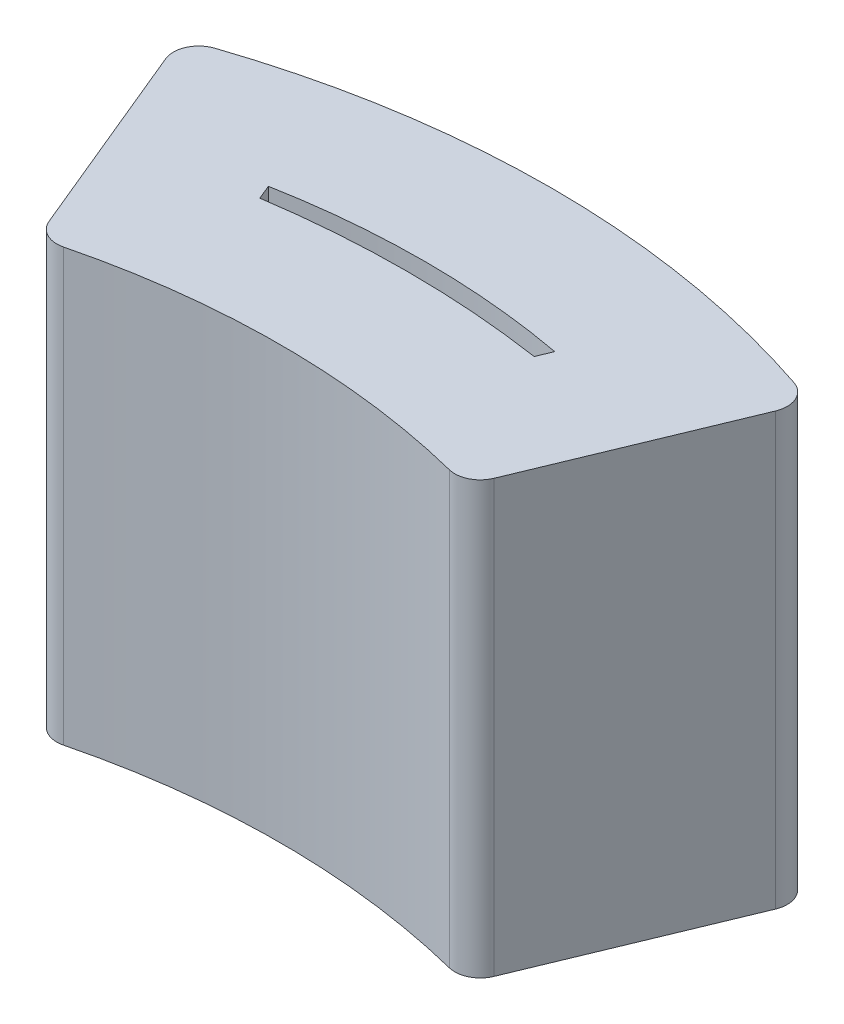
from build123d import *

# Parameters (mm, degrees)
BOSS_EXTRUDE1_DEPTH = 42.5


with BuildPart() as part:
    # Sketch1 → Boss-Extrude1 (new, symmetric)
    with BuildSketch(Plane(origin=(0, 0, 0), x_dir=(1, 0, 0), z_dir=(0, 1, 0))):
        with BuildLine():
            Line((-43.393852632, -25.264521876), (-59.645031086, 13.969293553))
            ThreePointArc((-59.645031086, 13.969293553), (-59.576188638, 17.954532916), (-56.615582649, 20.623181309))
            ThreePointArc((-56.615582649, 20.623181309), (0.444031685, 29.937093688), (57.50364602, 20.623181309))
            ThreePointArc((57.50364602, 20.623181309), (60.464252009, 17.954532916), (60.533094457, 13.969293553))
            Line((60.533094457, 13.969293553), (44.281916002, -25.264521876))
            ThreePointArc((44.281916002, -25.264521876), (41.909163826, -27.81793626), (38.444552916, -28.200492328))
            ThreePointArc((38.444552916, -28.200492328), (0.444031685, -23.501385869), (-37.556489545, -28.200492328))
            ThreePointArc((-37.556489545, -28.200492328), (-41.021100455, -27.81793626), (-43.393852632, -25.264521876))
        make_face()
        with BuildLine():
            Line((-26.579395894, -0.530063133), (-27.767590131, 2.338491509))
            ThreePointArc((-27.767590131, 2.338491509), (0.444031685, 4.937093688), (28.655653502, 2.338491509))
            Line((28.655653502, 2.338491509), (27.467459265, -0.530063133))
            ThreePointArc((27.467459265, -0.530063133), (0.444031685, 1.498614131), (-26.579395894, -0.530063133))
        make_face(mode=Mode.SUBTRACT)
    extrude(amount=BOSS_EXTRUDE1_DEPTH, both=True)


solid = part.part
